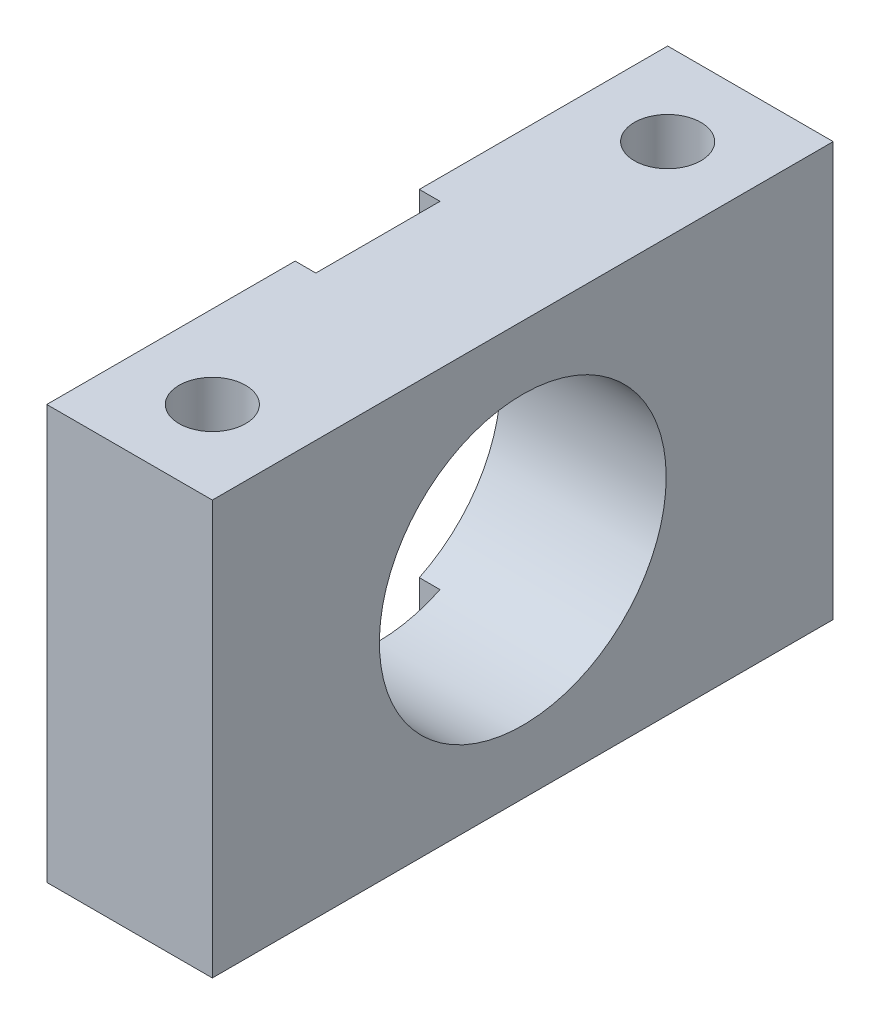
from build123d import *

# Parameters (mm, degrees)
SKETCH1_W           = 47.625
SKETCH1_H           = 31.75
SKETCH1_R           = 11
BOSS_EXTRUDE1_DEPTH = 6.35
SKETCH3_R           = 2.5527
CUT_EXTRUDE2_DEPTH  = 41.192289761
SKETCH4_W           = 9.525
SKETCH4_H           = 35.649275258
CUT_EXTRUDE3_DEPTH  = 1.5875


with BuildPart() as part:
    # Sketch1 → Boss-Extrude1 (new, symmetric)
    with BuildSketch(Plane(origin=(0, 0, 0), x_dir=(0, 0, -1), z_dir=(1, 0, 0))):
        Rectangle(SKETCH1_W, SKETCH1_H)
        Circle(SKETCH1_R, mode=Mode.SUBTRACT)
    extrude(amount=BOSS_EXTRUDE1_DEPTH, both=True)

    # Sketch3 → Cut-Extrude2 (cut, through all)
    with BuildSketch(Plane.XZ.offset(15.875)):
        with Locations(Location((0, 17.4625, 0), (0, 0, 270))):
            Circle(SKETCH3_R)
    cut_extrude2 = extrude(amount=-CUT_EXTRUDE2_DEPTH, mode=Mode.SUBTRACT)

    # Mirror1: Cut-Extrude2 across plane
    add(cut_extrude2.mirror(Plane.XY), mode=Mode.SUBTRACT)

    # Sketch4 → Cut-Extrude3 (cut)
    with BuildSketch(Plane.ZY.offset(6.35)):
        Rectangle(SKETCH4_W, SKETCH4_H)
    extrude(amount=-CUT_EXTRUDE3_DEPTH, mode=Mode.SUBTRACT)


solid = part.part
